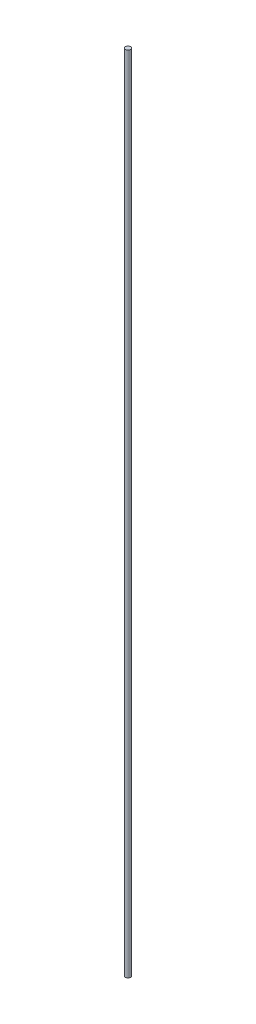
from build123d import *

# Parameters (mm, degrees)
SWEEP1_PROFILE_R = 6.35


with BuildPart() as part:
    # Sweep1: sweep along a path in Sketch1
    with BuildLine(Plane.XY) as sweep1_path:
        Line((0, 0), (0, 1993.646))
    # Sweep1 profile (on start of the path) → Sweep1 (sweep)
    with BuildSketch(Plane.ZX):
        Circle(SWEEP1_PROFILE_R)
    sweep(path=sweep1_path.line)


solid = part.part
